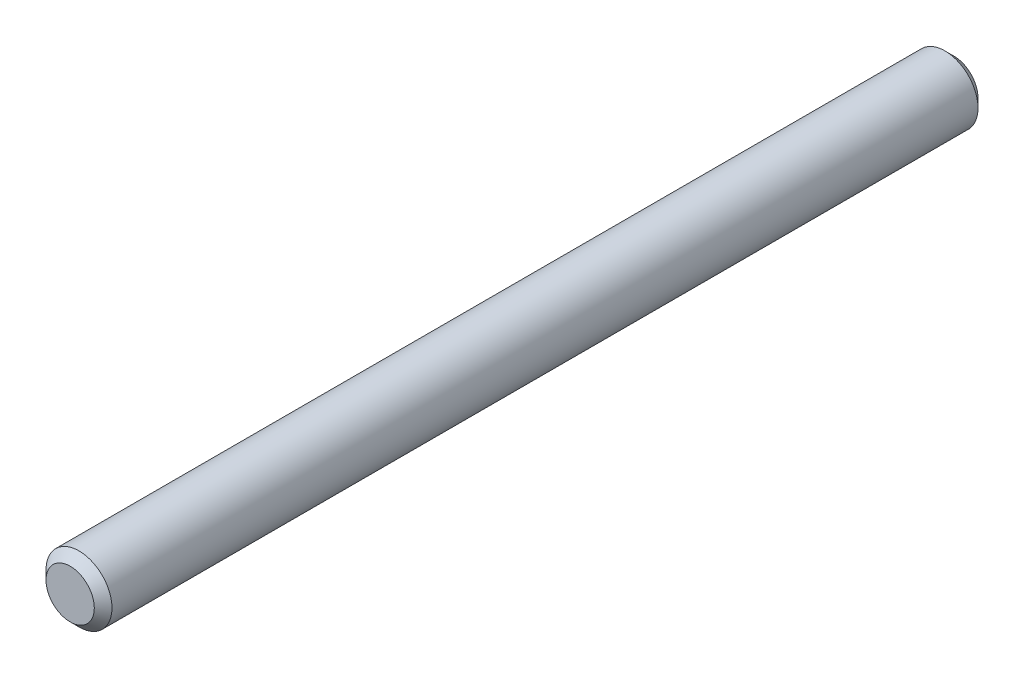
from build123d import *

# Parameters (mm, degrees)
SKETCH1_R      = 1.4224
EXTRUDE1_DEPTH = 38.1
CHAMFER1_SIZE  = 0.381


with BuildPart() as part:
    # Sketch1 → Extrude1 (new body)
    with BuildSketch(Plane.XY):
        Circle(SKETCH1_R)
    extrude(amount=-EXTRUDE1_DEPTH)

    # Chamfer1
    chamfer1_edges = [part.edges().sort_by_distance(p)[0] for p in [
        (-1.4224, 0, 0),
        (-1.4224, 0, -38.1),
    ]]
    chamfer(chamfer1_edges, length=CHAMFER1_SIZE)


solid = part.part
